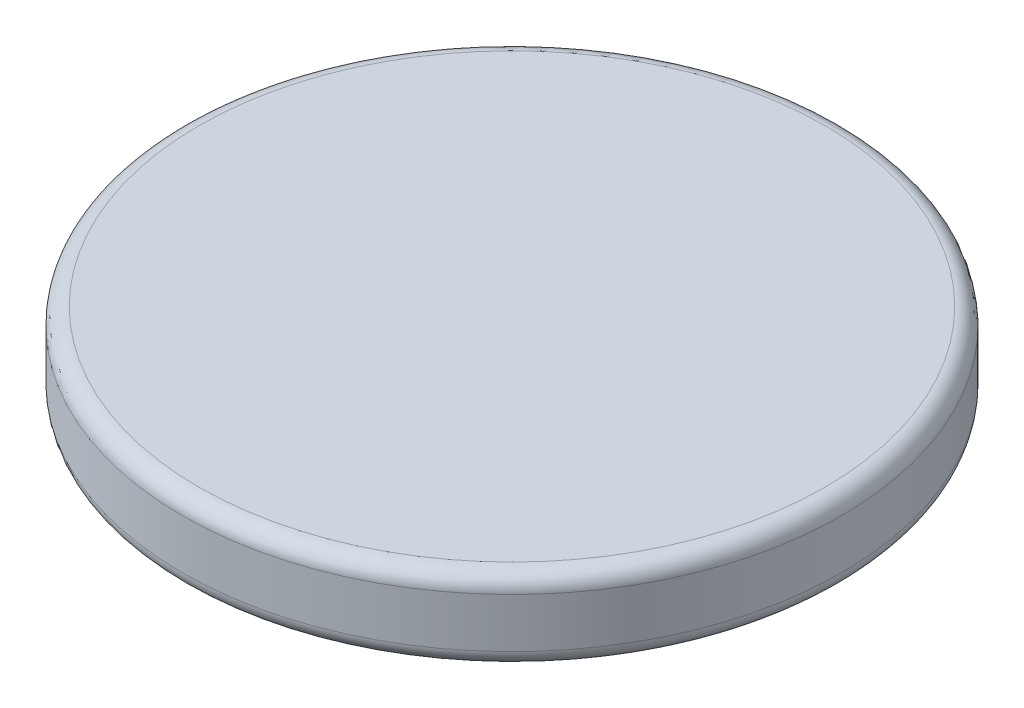
from build123d import *

# Parameters (mm, degrees)
SKETCH4_R           = 40
BOSS_EXTRUDE1_DEPTH = 10
FILLET1_R           = 2


with BuildPart() as part:
    # Sketch4 → Boss-Extrude1 (new body)
    with BuildSketch(Plane(origin=(0, 0, 0), x_dir=(1, 0, 0), z_dir=(0, 1, 0))):
        with Locations(Location((0, 0, 0), (0, 0, 270))):
            Circle(SKETCH4_R)
    extrude(amount=BOSS_EXTRUDE1_DEPTH)

    # Fillet1
    fillet1_edges = [part.edges().sort_by_distance(p)[0] for p in [
        (0, 0, -40),
        (0, 10, -40),
    ]]
    fillet(fillet1_edges, radius=FILLET1_R)


solid = part.part
